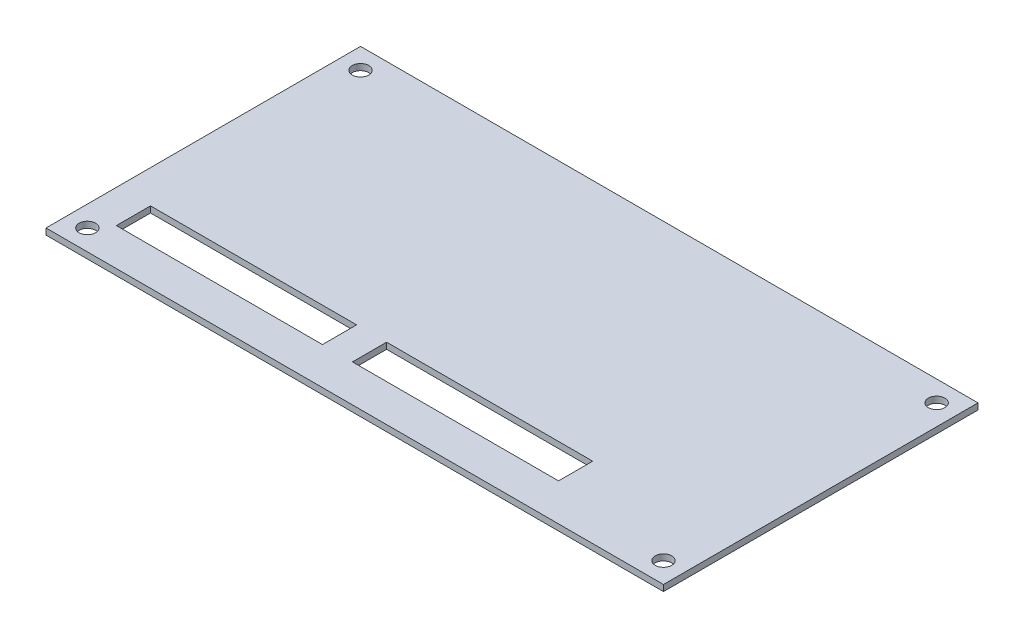
from build123d import *

# Parameters (mm, degrees)
SKETCH1_W           = 149.2
SKETCH1_H           = 76
SKETCH1_R           = 2
SKETCH1_W_2         = 49.8
SKETCH1_H_2         = 8.25
BOSS_EXTRUDE1_DEPTH = 1.5


with BuildPart() as part:
    # Sketch1 → Boss-Extrude1 (new body)
    with BuildSketch(Plane(origin=(0, 0, 0), x_dir=(1, 0, 0), z_dir=(0, 1, 0))):
        Rectangle(SKETCH1_W, SKETCH1_H)
        with Locations(Location((-69.6, 33, 0), (0, 0, 270))):
            Circle(SKETCH1_R, mode=Mode.SUBTRACT)
        with Locations(Location((69.6, 33, 0), (0, 0, 270))):
            Circle(SKETCH1_R, mode=Mode.SUBTRACT)
        with Locations(Location((69.6, -33, 0), (0, 0, 270))):
            Circle(SKETCH1_R, mode=Mode.SUBTRACT)
        with Locations(Location((-69.6, -33, 0), (0, 0, 270))):
            Circle(SKETCH1_R, mode=Mode.SUBTRACT)
        with Locations((-41.7, -24.875)):
            Rectangle(SKETCH1_W_2, SKETCH1_H_2, mode=Mode.SUBTRACT)
        with Locations((15.35, -24.875)):
            Rectangle(SKETCH1_W_2, SKETCH1_H_2, mode=Mode.SUBTRACT)
    extrude(amount=-BOSS_EXTRUDE1_DEPTH)


solid = part.part
